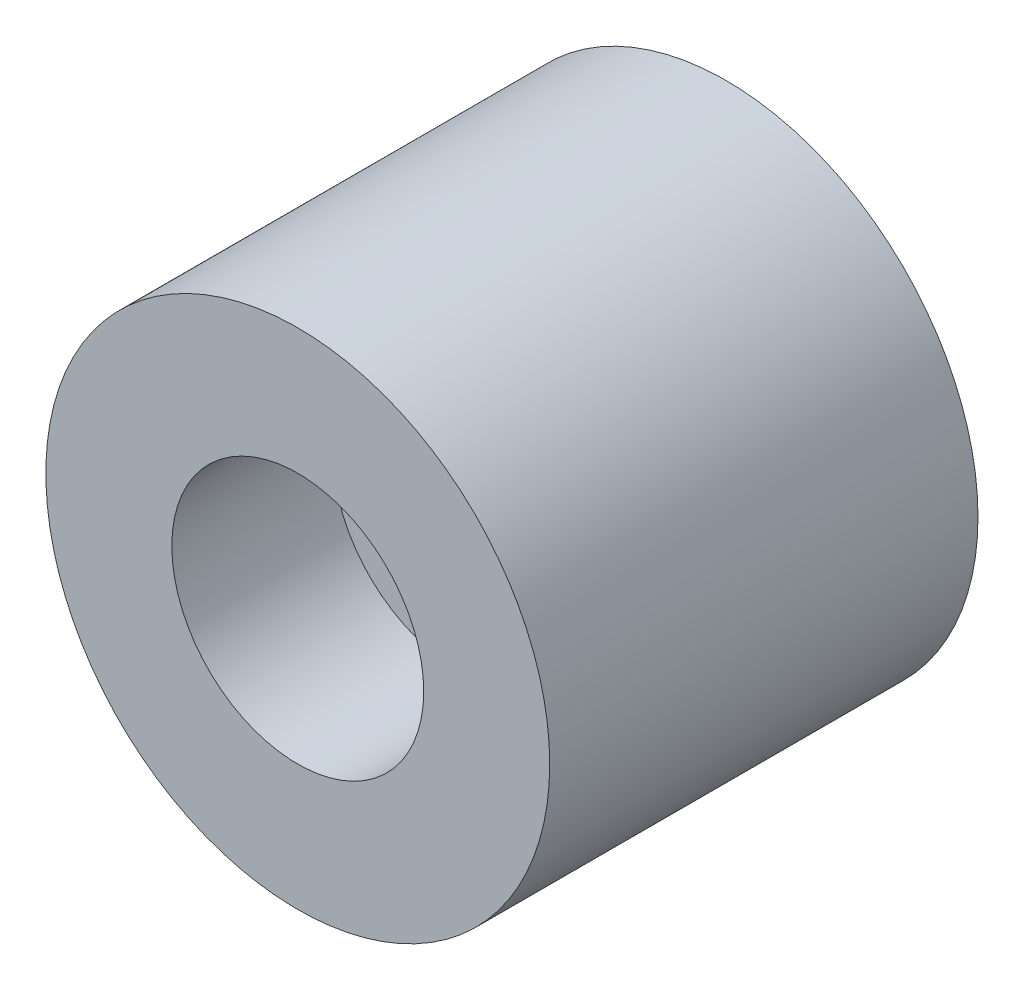
from build123d import *

# Parameters (mm, degrees)
SKETCH2_R           = 5
BOSS_EXTRUDE1_DEPTH = 8.5
CUT_EXTRUDE1_DEPTH  = 5
SKETCH3_R           = 2.5
CUT_EXTRUDE2_DEPTH  = 3.2
SKETCH5_R           = 0.35
CUT_EXTRUDE4_DEPTH  = 1


with BuildPart() as part:
    # Sketch2 → Boss-Extrude1 (new body)
    with BuildSketch(Plane.XY):
        Circle(SKETCH2_R)
    extrude(amount=BOSS_EXTRUDE1_DEPTH)

    # Sketch1 → Cut-Extrude1 (cut)
    with BuildSketch(Plane.XY):
        with BuildLine():
            Line((-0.447213595, 1.394427191), (-1.135934639, 2.771869278))
            ThreePointArc((-1.135934639, 2.771869278), (-1.447076632, 3.029390861), (-1.847006274, 2.972972894))
            ThreePointArc((-1.847006274, 2.972972894), (-3.5, 0), (-1.847006274, -2.972972894))
            ThreePointArc((-1.847006274, -2.972972894), (-1.447076632, -3.029390861), (-1.135934639, -2.771869278))
            Line((-1.135934639, -2.771869278), (-0.447213595, -1.394427191))
            ThreePointArc((-0.447213595, -1.394427191), (0, -1.118033989), (0.447213595, -1.394427191))
            Line((0.447213595, -1.394427191), (1.135934639, -2.771869278))
            ThreePointArc((1.135934639, -2.771869278), (1.447076632, -3.029390861), (1.847006274, -2.972972894))
            ThreePointArc((1.847006274, -2.972972894), (3.5, 0), (1.847006274, 2.972972894))
            ThreePointArc((1.847006274, 2.972972894), (1.447076632, 3.029390861), (1.135934639, 2.771869278))
            Line((1.135934639, 2.771869278), (0.447213595, 1.394427191))
            ThreePointArc((0.447213595, 1.394427191), (0, 1.118033989), (-0.447213595, 1.394427191))
        make_face()
    extrude(amount=CUT_EXTRUDE1_DEPTH, mode=Mode.SUBTRACT)

    # Sketch3 → Cut-Extrude2 (cut)
    with BuildSketch(Plane.XY.offset(8.5)):
        Circle(SKETCH3_R)
    extrude(amount=-CUT_EXTRUDE2_DEPTH, mode=Mode.SUBTRACT)

    # Sketch5 → Cut-Extrude4 (cut)
    with BuildSketch(Plane(origin=(0, 0, 5), x_dir=(-1, 0, 0), z_dir=(0, 0, -1))):
        Circle(SKETCH5_R)
    extrude(amount=-CUT_EXTRUDE4_DEPTH, mode=Mode.SUBTRACT)


solid = part.part
